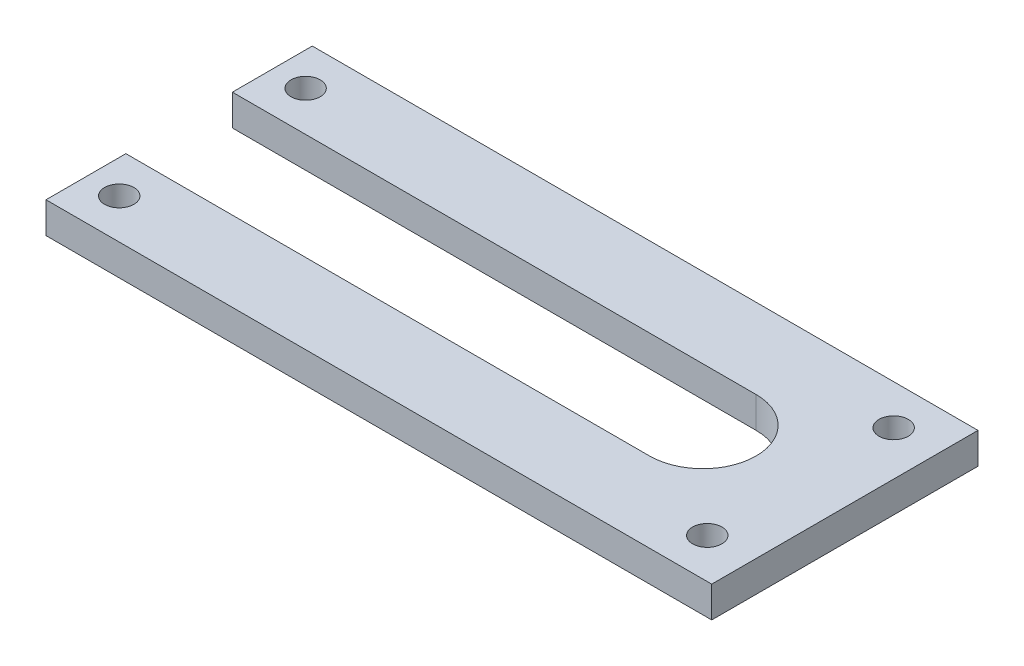
from build123d import *

# Parameters (mm, degrees)
SCHIZZO1_W                   = 150
SCHIZZO1_H                   = 7
ESTRUSIONE_ESTRUSIONE1_DEPTH = 80
SCHIZZO2_W                   = 203.570811829
SCHIZZO2_H                   = 138.674141949
SCHIZZO2_R                   = 3.3
TAGLIO_ESTRUSIONE1_DEPTH     = 171.144056611


with BuildPart() as part:
    # Schizzo1 → Estrusione-Estrusione1 (new body)
    with BuildSketch(Plane.XY):
        with Locations((75, 3.5)):
            Rectangle(SCHIZZO1_W, SCHIZZO1_H)
    extrude(amount=-ESTRUSIONE_ESTRUSIONE1_DEPTH)

    # Schizzo2 → Taglio-Estrusione1 (cut, through all)
    # profile 1 of 5: a face of its own
    with BuildSketch(Plane(origin=(0, 0, 0), x_dir=(1, 0, 0), z_dir=(0, 1, 0))):
        with Locations((73.083648688, 28.492060902)):
            Rectangle(SCHIZZO2_W, SCHIZZO2_H)
        with BuildLine():
            Line((0, 18), (118, 18))
            ThreePointArc((118, 18), (130, 30), (118, 42))
            Line((118, 42), (0, 42))
            Line((0, 42), (0, 60))
            Line((0, 60), (150, 60))
            Line((150, 60), (150, 0))
            Line((150, 0), (0, 0))
            Line((0, 0), (0, 18))
        make_face(mode=Mode.SUBTRACT)
    # profile 2 of 5: a face of its own
    with BuildSketch(Plane(origin=(0, 0, 0), x_dir=(1, 0, 0), z_dir=(0, 1, 0))):
        with Locations(Location((140, 9, 0), (0, 0, 90))):
            Circle(SCHIZZO2_R)
    # profile 3 of 5: a face of its own
    with BuildSketch(Plane(origin=(0, 0, 0), x_dir=(1, 0, 0), z_dir=(0, 1, 0))):
        with Locations(Location((140, 51, 0), (0, 0, 270))):
            Circle(SCHIZZO2_R)
    # profile 4 of 5: a face of its own
    with BuildSketch(Plane(origin=(0, 0, 0), x_dir=(1, 0, 0), z_dir=(0, 1, 0))):
        with Locations(Location((7.5, 9, 0), (0, 0, 90))):
            Circle(SCHIZZO2_R)
    # profile 5 of 5: a face of its own
    with BuildSketch(Plane(origin=(0, 0, 0), x_dir=(1, 0, 0), z_dir=(0, 1, 0))):
        with Locations(Location((7.5, 51, 0), (0, 0, 270))):
            Circle(SCHIZZO2_R)
    extrude(amount=TAGLIO_ESTRUSIONE1_DEPTH, mode=Mode.SUBTRACT)


solid = part.part
